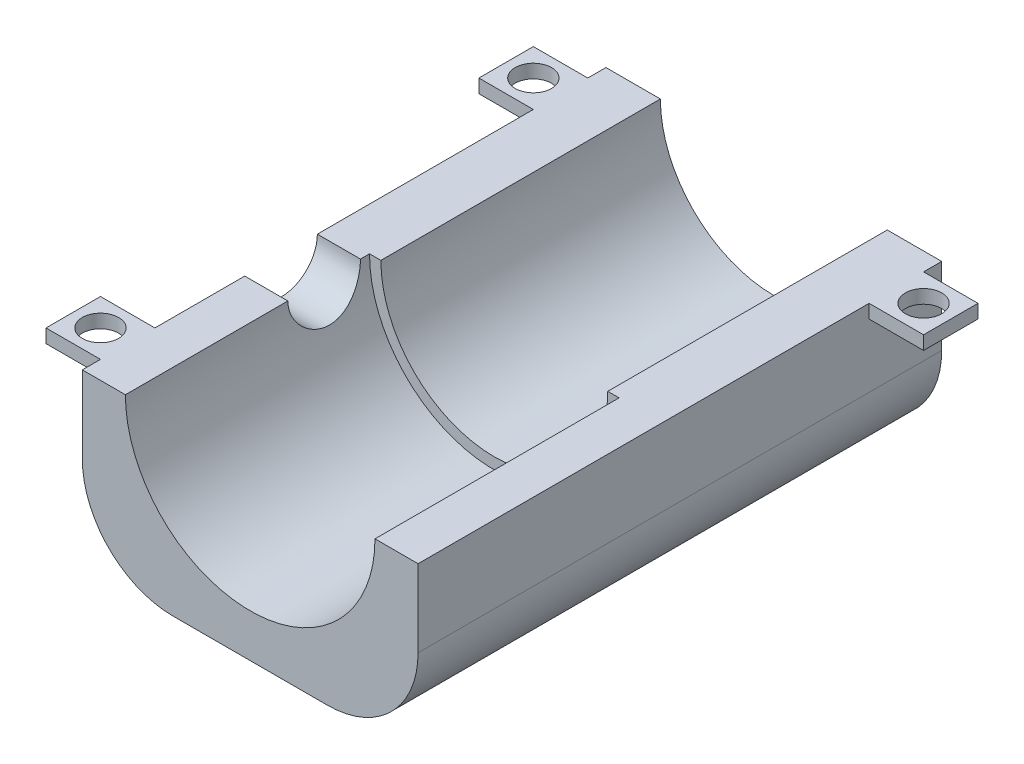
from build123d import *

# Parameters (mm, degrees)
EXTRUDE_1_DEPTH     = 57.7
EXTRUDE_2_DEPTH     = 30.8
SKETCH_5_R          = 4
CUT_EXTRUDE_1_DEPTH = 15
FILLET_1_R          = 10
SKETCH_6_W          = 6
SKETCH_6_H          = 1.5
EXTRUDE_3_DEPTH     = 6
EXTRUDE_START       = -37
SKETCH_6_3_W        = 6
SKETCH_6_3_H        = 1.5
EXTRUDE_4_DEPTH     = 6
SKETCH_7_R          = 2
CUT_EXTRUDE_2_DEPTH = 6
SKETCH_8_W          = 14.5
SKETCH_8_H          = 25.5
CUT_EXTRUDE_3_DEPTH = 2
CUT_EXTRUDE_START   = -26.9
CUT_EXTRUDE_4_DEPTH = 26.9
CUT_EXTRUDE_5_DEPTH = 44.487239508
SKETCH_11_W         = 6
SKETCH_11_H         = 6
CUT_EXTRUDE_6_DEPTH = 10


with BuildPart() as part:
    # 스케치1 → 보스-돌출1 (new body)
    with BuildSketch(Plane.XY):
        with BuildLine():
            Line((-13.5, 0), (-18.5, 0))
            Line((-18.5, 0), (-18.5, -18.5))
            Line((-18.5, -18.5), (18.5, -18.5))
            Line((18.5, -18.5), (18.5, 0))
            Line((18.5, 0), (13.5, 0))
            ThreePointArc((13.5, 0), (0, -13.5), (-13.5, 0))
        make_face()
    extrude(amount=-EXTRUDE_1_DEPTH)

    # 스케치3 → 보스-돌출2 (add)
    with BuildSketch(Plane.XY.offset(-26.9)):
        with BuildLine():
            Line((-13.5, 0), (-11.5, 0))
            ThreePointArc((-11.5, 0), (0, -11.5), (11.5, 0))
            Line((11.5, 0), (13.5, 0))
            ThreePointArc((13.5, 0), (0, -13.5), (-13.5, 0))
        make_face()
    extrude(amount=-EXTRUDE_2_DEPTH)

    # 스케치5 → 컷-돌출1 (cut)
    with BuildSketch(Plane.ZY.offset(18.5)):
        with Locations((-21.9, 0)):
            Circle(SKETCH_5_R)
    extrude(amount=-CUT_EXTRUDE_1_DEPTH, mode=Mode.SUBTRACT)

    # 필렛1
    fillet_1_edges = [part.edges().sort_by_distance(p)[0] for p in [
        (18.5, -18.5, -28.85),
        (-18.5, -18.5, -28.85),
    ]]
    fillet(fillet_1_edges, radius=FILLET_1_R)

    # 스케치6 → 보스-돌출3 (add)
    with BuildSketch(Plane(origin=(18.5, 0, 0), x_dir=(0, 0, -1), z_dir=(1, 0, 0))):
        with Locations((52.7, -0.75)):
            Rectangle(SKETCH_6_W, SKETCH_6_H)
        with Locations((5, -0.75)):
            Rectangle(SKETCH_6_W, SKETCH_6_H)
    extrude(amount=EXTRUDE_3_DEPTH)

    # 스케치6<3> → 보스-돌출4 (add)
    with BuildSketch(Plane(origin=(18.5, 0, 0), x_dir=(0, 0, -1), z_dir=(1, 0, 0)).offset(EXTRUDE_START)):
        with Locations((52.7, -0.75)):
            Rectangle(SKETCH_6_3_W, SKETCH_6_3_H)
        with Locations((5, -0.75)):
            Rectangle(SKETCH_6_3_W, SKETCH_6_3_H)
    extrude(amount=-EXTRUDE_4_DEPTH)

    # 스케치7 → 컷-돌출2 (cut)
    with BuildSketch(Plane(origin=(0, 0, 0), x_dir=(1, 0, 0), z_dir=(0, 1, 0))):
        with Locations(Location((21.5, 5, 0), (0, 0, 270))):
            Circle(SKETCH_7_R)
        with Locations(Location((21.5, 52.7, 0), (0, 0, 270))):
            Circle(SKETCH_7_R)
        with Locations(Location((-21.5, 5, 0), (0, 0, 180))):
            Circle(SKETCH_7_R)
        with Locations((-21.5, 52.7)):
            Circle(SKETCH_7_R)
    extrude(amount=-CUT_EXTRUDE_2_DEPTH, mode=Mode.SUBTRACT)

    # 스케치8 → 컷-돌출3 (cut)
    with BuildSketch(Plane.XZ.offset(18.5)):
        with Locations((0, -42.95)):
            Rectangle(SKETCH_8_W, SKETCH_8_H)
    extrude(amount=-CUT_EXTRUDE_3_DEPTH, mode=Mode.SUBTRACT)

    # 스케치9 → 컷-돌출4 (cut)
    with BuildSketch(Plane.XY.offset(CUT_EXTRUDE_START)):
        with BuildLine():
            Line((-13.5, 0), (-13.75, 0))
            ThreePointArc((-13.75, 0), (0, -13.75), (13.75, 0))
            Line((13.75, 0), (13.5, 0))
            ThreePointArc((13.5, 0), (0, -13.5), (-13.5, 0))
        make_face()
    extrude(amount=CUT_EXTRUDE_4_DEPTH, mode=Mode.SUBTRACT)

    # 스케치10 → 컷-돌출5 (cut, through all)
    with BuildSketch(Plane.XY.offset(-26.9)):
        with BuildLine():
            ThreePointArc((11.5, 0), (0, -11.5), (-11.5, 0))
            Line((-11.5, 0), (-12.5, 0))
            ThreePointArc((-12.5, 0), (0, -12.5), (12.5, 0))
            Line((12.5, 0), (11.5, 0))
        make_face()
    extrude(amount=-CUT_EXTRUDE_5_DEPTH, mode=Mode.SUBTRACT)

    # 스케치11 → 컷-돌출6 (cut)
    with BuildSketch(Plane.XZ.offset(1.5)):
        with Locations((21.5, -5)):
            Rectangle(SKETCH_11_W, SKETCH_11_H)
    extrude(amount=-CUT_EXTRUDE_6_DEPTH, mode=Mode.SUBTRACT)


solid = part.part
